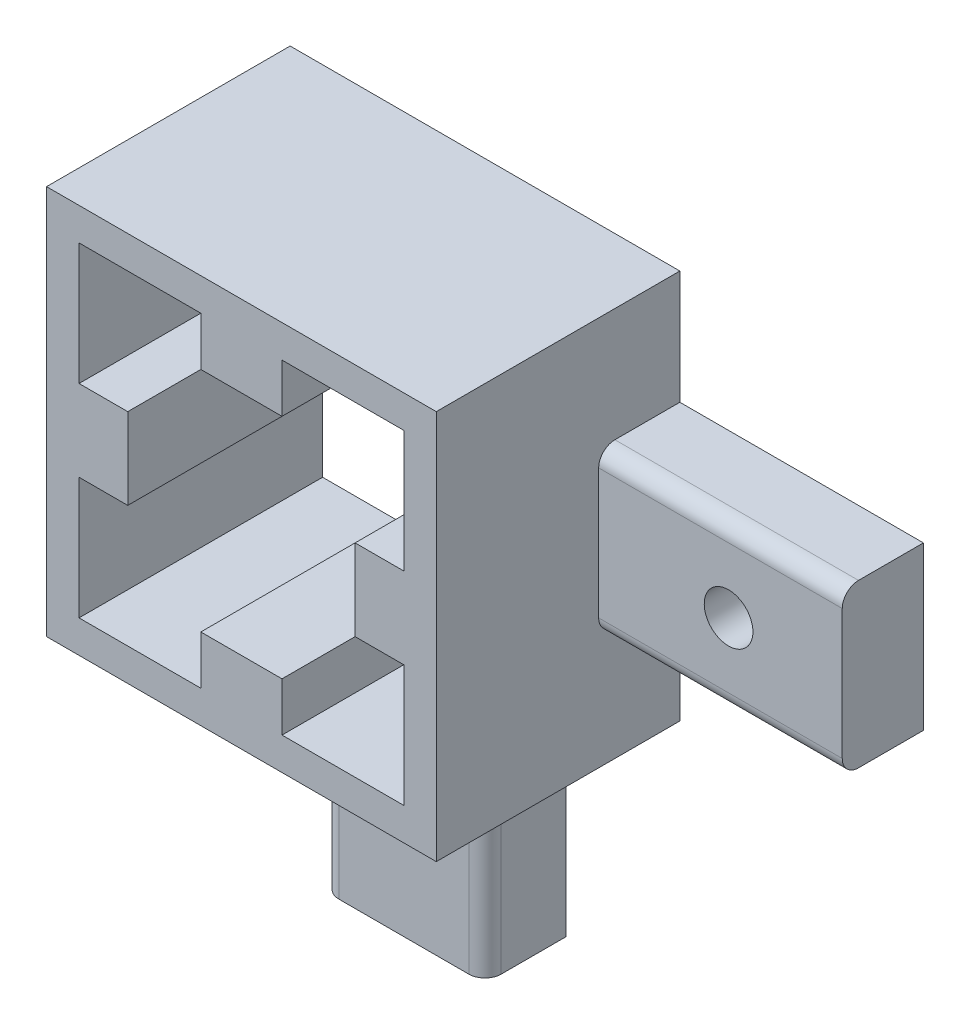
from build123d import *

# Parameters (mm, degrees)
SKETCH2_W           = 24
SKETCH2_H           = 24
BOSS_EXTRUDE1_DEPTH = 15
BOSS_EXTRUDE2_DEPTH = 15
CUT_EXTRUDE1_REACH  = 33.193
SKETCH4_R           = 1.5
CIRPATTERN1_COUNT   = 2
CIRPATTERN1_ANGLE   = 90


with BuildPart() as part:
    # Sketch2 → Boss-Extrude1 (new body)
    with BuildSketch(Plane.XY):
        Rectangle(SKETCH2_W, SKETCH2_H)
        Polygon((-2.5, 10), (-2.5, 7), (2.5, 7), (2.5, 10), (10, 10), (10, 2.5), (7, 2.5), (7, -2.5), (10, -2.5), (10, -10), (2.5, -10), (2.5, -7), (-2.5, -7), (-2.5, -10), (-10, -10), (-10, -2.5), (-7, -2.5), (-7, 2.5), (-10, 2.5), (-10, 10), align=None, mode=Mode.SUBTRACT)
    extrude(amount=BOSS_EXTRUDE1_DEPTH)

    # Sketch3 → Boss-Extrude2 (add)
    with BuildSketch(Plane.XZ.offset(12)):
        with BuildLine():
            Line((-5, 4), (-5, 0))
            Line((-5, 0), (5, 0))
            Line((5, 0), (5, 4))
            ThreePointArc((5, 4), (4.707106781, 4.707106781), (4, 5))
            Line((4, 5), (-4, 5))
            ThreePointArc((-4, 5), (-4.707106781, 4.707106781), (-5, 4))
        make_face()
    boss_extrude2 = extrude(amount=BOSS_EXTRUDE2_DEPTH)

    # Sketch4 → Cut-Extrude1 (cut, up to next)
    with BuildSketch(Plane.XY.offset(5), mode=Mode.PRIVATE) as cut_extrude1_sk1:
        with Locations((0, -20)):
            Circle(SKETCH4_R)
    cut_extrude1_tool1 = extrude(cut_extrude1_sk1.sketch, amount=-CUT_EXTRUDE1_REACH, mode=Mode.PRIVATE) & part.part
    cut_extrude1 = cut_extrude1_tool1.solids().sort_by_distance((0, -20, 5))[0]
    add(cut_extrude1, mode=Mode.SUBTRACT)

    # CirPattern1: Boss-Extrude2, Cut-Extrude1 ×2 about axis
    cirpattern1_axis = Axis((0, 0, 0), (0, 0, 1))
    add([boss_extrude2.rotate(cirpattern1_axis, i * CIRPATTERN1_ANGLE / (CIRPATTERN1_COUNT - 1)) for i in range(1, CIRPATTERN1_COUNT)])
    add([cut_extrude1.rotate(cirpattern1_axis, i * CIRPATTERN1_ANGLE / (CIRPATTERN1_COUNT - 1)) for i in range(1, CIRPATTERN1_COUNT)], mode=Mode.SUBTRACT)


solid = part.part
